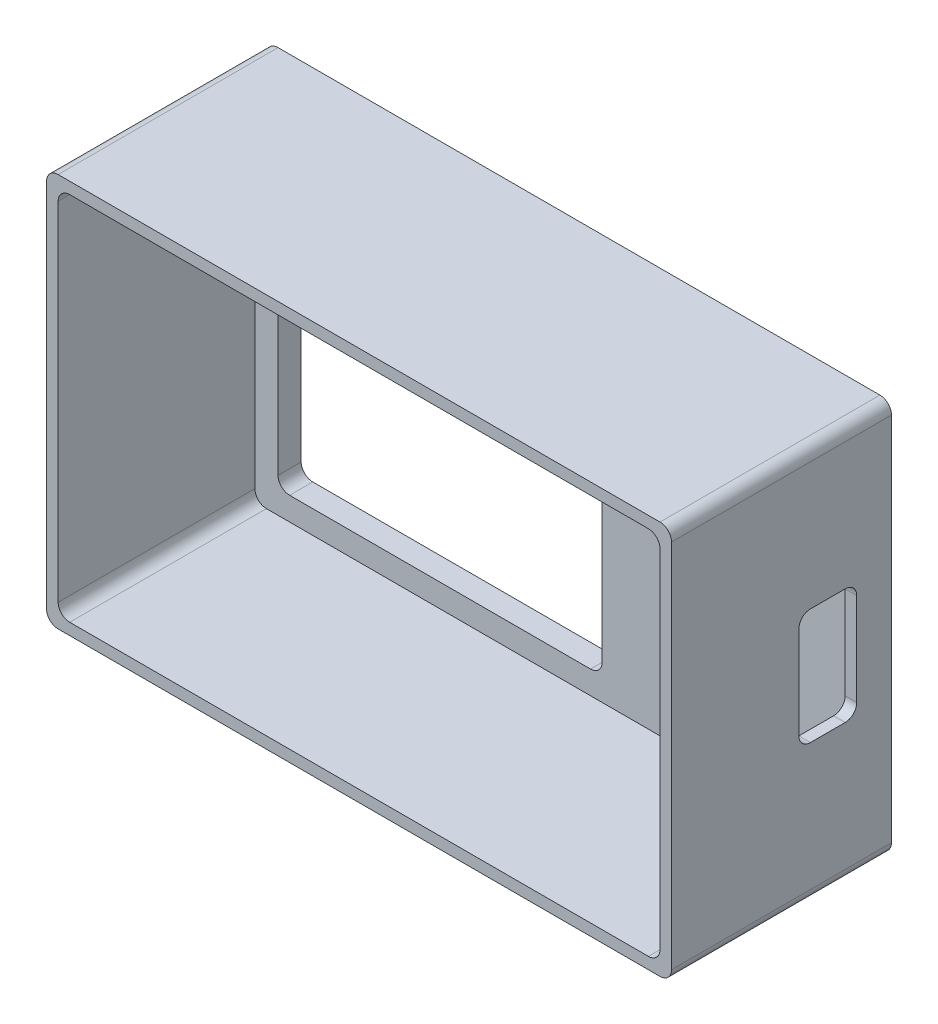
from build123d import *

# Parameters (mm, degrees)
SKETCH1_W           = 54
SKETCH1_H           = 34
SKETCH1_W_2         = 28
SKETCH1_H_2         = 28
BOSS_EXTRUDE1_DEPTH = 2
SKETCH2_W           = 54
SKETCH2_H           = 34
SKETCH2_W_2         = 52
SKETCH2_H_2         = 32
BOSS_EXTRUDE2_DEPTH = 17
FILLET1_R           = 1
FILLET2_R           = 1
SKETCH3_W           = 5
SKETCH3_H           = 10
CUT_EXTRUDE1_DEPTH  = 17
FILLET3_R           = 1
FILLET4_R           = 1


with BuildPart() as part:
    # Sketch1 → Boss-Extrude1 (new body)
    with BuildSketch(Plane.XY):
        Rectangle(SKETCH1_W, SKETCH1_H)
        with Locations((-10, 0)):
            Rectangle(SKETCH1_W_2, SKETCH1_H_2, mode=Mode.SUBTRACT)
    extrude(amount=BOSS_EXTRUDE1_DEPTH)

    # Sketch2 → Boss-Extrude2 (add)
    with BuildSketch(Plane.XY.offset(2)):
        Rectangle(SKETCH2_W, SKETCH2_H)
        Rectangle(SKETCH2_W_2, SKETCH2_H_2, mode=Mode.SUBTRACT)
    extrude(amount=BOSS_EXTRUDE2_DEPTH)

    # Fillet1
    fillet1_edges = [part.edges().sort_by_distance(p)[0] for p in [
        (26, 16, 10.5),
        (-26, 16, 10.5),
        (-26, -16, 10.5),
        (26, -16, 10.5),
    ]]
    fillet(fillet1_edges, radius=FILLET1_R)

    # Fillet2
    fillet2_edges = [part.edges().sort_by_distance(p)[0] for p in [
        (27, -17, 9.5),
        (-27, -17, 9.5),
        (-27, 17, 9.5),
        (27, 17, 9.5),
    ]]
    fillet(fillet2_edges, radius=FILLET2_R)

    # Sketch3 → Cut-Extrude1 (cut)
    with BuildSketch(Plane(origin=(27, 0, 0), x_dir=(0, 0, -1), z_dir=(1, 0, 0))):
        with Locations((-5.5, 0)):
            Rectangle(SKETCH3_W, SKETCH3_H)
    extrude(amount=-CUT_EXTRUDE1_DEPTH, mode=Mode.SUBTRACT)

    # Fillet3
    fillet3_edges = [part.edges().sort_by_distance(p)[0] for p in [
        (26.5, 5, 3),
        (26.5, -5, 3),
        (26.5, -5, 8),
        (26.5, 5, 8),
    ]]
    fillet(fillet3_edges, radius=FILLET3_R)

    # Fillet4
    fillet4_edges = [part.edges().sort_by_distance(p)[0] for p in [
        (4, -14, 1),
        (4, 14, 1),
        (-24, 14, 1),
        (-24, -14, 1),
    ]]
    fillet(fillet4_edges, radius=FILLET4_R)


solid = part.part
